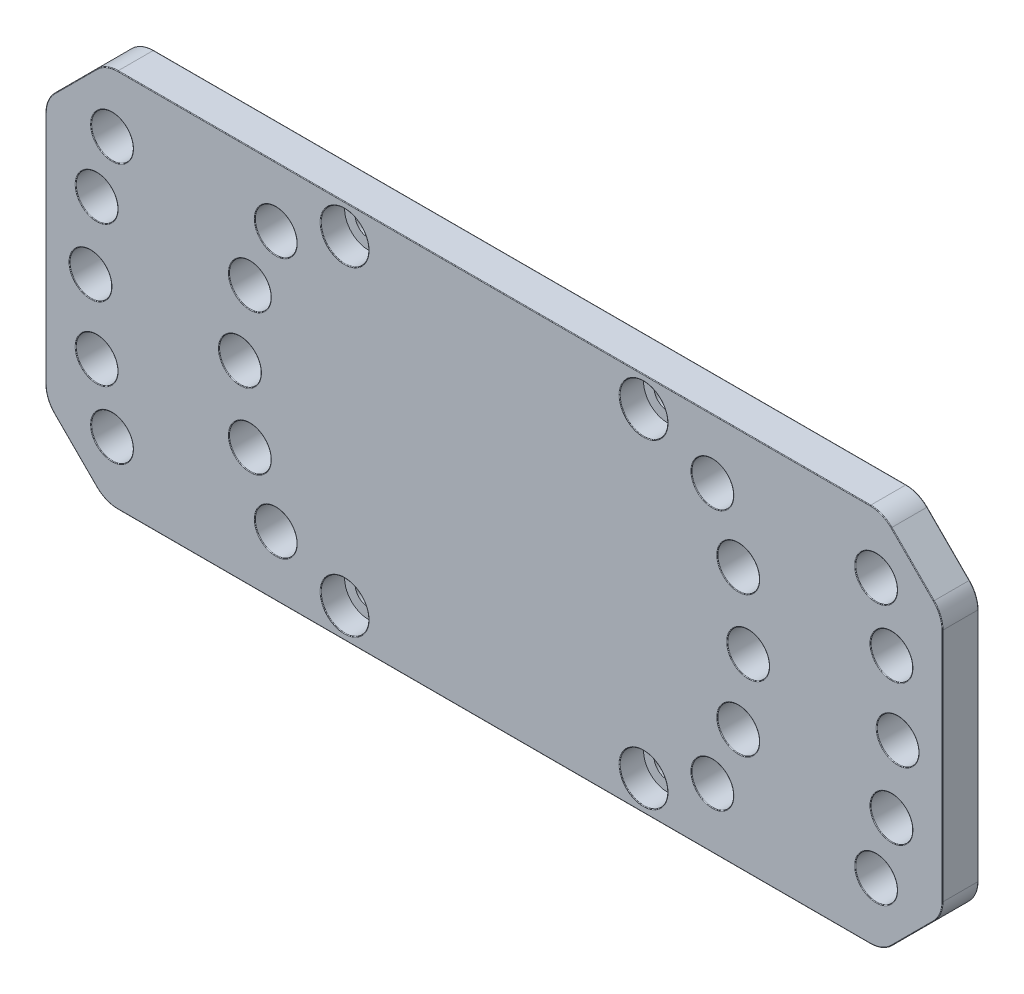
from build123d import *

# Parameters (mm, degrees)
EXTRUDE_2_DEPTH             = 6
HOLE_WIZARD_M41_D           = 4.5
HOLE_WIZARD_M41_CBORE_D     = 8
HOLE_WIZARD_M41_CBORE_DEPTH = 4
SKETCH_13_R                 = 3.5
CUT_EXTRUDE_1_DEPTH         = 82.664328198
FILLET_1_R                  = 5
FILLET_2_R                  = 0.1


with BuildPart() as part:
    # Эскиз5 → Бобышка-Вытянуть2 (new body)
    with BuildSketch(Plane.XY):
        Polygon((-75, 21.75), (-65, 31.75), (65, 31.75), (75, 21.75), (75, -21.75), (65, -31.75), (-65, -31.75), (-75, -21.75), align=None)
    extrude(amount=EXTRUDE_2_DEPTH)

    # Цековка для винта с внутренним шестигранником M41 (through all)
    with Locations(Plane.XY.offset(6)):
        with Locations((-25, 26.75), (-25, -26.75), (25, -26.75), (25, 26.75)):
            CounterBoreHole(HOLE_WIZARD_M41_D / 2, HOLE_WIZARD_M41_CBORE_D / 2, HOLE_WIZARD_M41_CBORE_DEPTH)

    # Эскиз13 → Вырез-Вытянуть1 (cut, through all)
    with BuildSketch(Plane.XY.offset(6)):
        with Locations((-67.5, 0)):
            Circle(SKETCH_13_R)
        with Locations((-66.469447869, 11.75)):
            Circle(SKETCH_13_R)
        with Locations((-63.899823943, 21.75)):
            Circle(SKETCH_13_R)
        with Locations((-66.469447869, -11.75)):
            Circle(SKETCH_13_R)
        with Locations((-63.899823943, -21.75)):
            Circle(SKETCH_13_R)
        with Locations(Location((63.899823943, -21.75, 0), (0, 0, 180))):
            Circle(SKETCH_13_R)
        with Locations(Location((66.469447869, -11.75, 0), (0, 0, 180))):
            Circle(SKETCH_13_R)
        with Locations(Location((67.5, 0, 0), (0, 0, 180))):
            Circle(SKETCH_13_R)
        with Locations(Location((66.469447869, 11.75, 0), (0, 0, 180))):
            Circle(SKETCH_13_R)
        with Locations(Location((63.899823943, 21.75, 0), (0, 0, 180))):
            Circle(SKETCH_13_R)
        with Locations((-36.512840207, 21.75)):
            Circle(SKETCH_13_R)
        with Locations((-40.843451127, 11.75)):
            Circle(SKETCH_13_R)
        with Locations((-42.5, 0)):
            Circle(SKETCH_13_R)
        with Locations((-40.843451127, -11.75)):
            Circle(SKETCH_13_R)
        with Locations((-36.512840207, -21.75)):
            Circle(SKETCH_13_R)
        with Locations(Location((36.512840207, -21.75, 0), (0, 0, 180))):
            Circle(SKETCH_13_R)
        with Locations(Location((40.843451127, -11.75, 0), (0, 0, 180))):
            Circle(SKETCH_13_R)
        with Locations(Location((42.5, 0, 0), (0, 0, 180))):
            Circle(SKETCH_13_R)
        with Locations(Location((40.843451127, 11.75, 0), (0, 0, 180))):
            Circle(SKETCH_13_R)
        with Locations(Location((36.512840207, 21.75, 0), (0, 0, 180))):
            Circle(SKETCH_13_R)
    extrude(amount=-CUT_EXTRUDE_1_DEPTH, mode=Mode.SUBTRACT)

    # Скругление1
    fillet_1_edges = [part.edges().sort_by_distance(p)[0] for p in [
        (65, 31.75, 3),
        (75, 21.75, 3),
        (75, -21.75, 3),
        (65, -31.75, 3),
        (-65, -31.75, 3),
        (-75, -21.75, 3),
        (-75, 21.75, 3),
        (-65, 31.75, 3),
    ]]
    fillet(fillet_1_edges, radius=FILLET_1_R)

    # Скругление2
    fillet_2_edges = [part.edges().sort_by_distance(p)[0] for p in [
        (-44.343451127, -11.75, 0),
        (-44.343451127, -11.75, 6),
        (-40.012840207, -21.75, 0),
        (-40.012840207, -21.75, 6),
        (40.012840207, -21.75, 0),
        (40.012840207, -21.75, 6),
        (44.343451127, -11.75, 0),
        (44.343451127, -11.75, 6),
        (46, 0, 0),
        (46, 0, 6),
        (44.343451127, 11.75, 0),
        (44.343451127, 11.75, 6),
        (40.012840207, 21.75, 0),
        (40.012840207, 21.75, 6),
        (0, 31.75, 0),
        (0, 31.75, 6),
        (70, 26.75, 0),
        (75, 0, 0),
        (70, -26.75, 0),
        (0, -31.75, 0),
        (-70, -26.75, 0),
        (-75, 0, 0),
        (-70, 26.75, 0),
        (-64.84234935, 31.369397663, 0),
        (-74.619397663, 21.59234935, 0),
        (-74.619397663, -21.59234935, 0),
        (-64.84234935, -31.369397663, 0),
        (64.84234935, -31.369397663, 0),
        (74.619397663, -21.59234935, 0),
        (74.619397663, 21.59234935, 0),
        (64.84234935, 31.369397663, 0),
        (70, 26.75, 6),
        (-70, 26.75, 6),
        (-75, 0, 6),
        (-70, -26.75, 6),
        (0, -31.75, 6),
        (70, -26.75, 6),
        (75, 0, 6),
        (-64.84234935, 31.369397663, 6),
        (-74.619397663, 21.59234935, 6),
        (-74.619397663, -21.59234935, 6),
        (-64.84234935, -31.369397663, 6),
        (64.84234935, -31.369397663, 6),
        (74.619397663, -21.59234935, 6),
        (74.619397663, 21.59234935, 6),
        (64.84234935, 31.369397663, 6),
        (21, 26.75, 6),
        (27.25, 26.75, 0),
        (21, -26.75, 6),
        (27.25, -26.75, 0),
        (-29, -26.75, 6),
        (-22.75, -26.75, 0),
        (-29, 26.75, 6),
        (-22.75, 26.75, 0),
        (-71, 0, 0),
        (-71, 0, 6),
        (-69.969447869, 11.75, 0),
        (-69.969447869, 11.75, 6),
        (-67.399823943, 21.75, 0),
        (-67.399823943, 21.75, 6),
        (-69.969447869, -11.75, 0),
        (-69.969447869, -11.75, 6),
        (-67.399823943, -21.75, 0),
        (-67.399823943, -21.75, 6),
        (67.399823943, -21.75, 0),
        (67.399823943, -21.75, 6),
        (69.969447869, -11.75, 0),
        (69.969447869, -11.75, 6),
        (71, 0, 0),
        (71, 0, 6),
        (69.969447869, 11.75, 0),
        (69.969447869, 11.75, 6),
        (67.399823943, 21.75, 0),
        (67.399823943, 21.75, 6),
        (-40.012840207, 21.75, 0),
        (-40.012840207, 21.75, 6),
        (-44.343451127, 11.75, 0),
        (-44.343451127, 11.75, 6),
        (-46, 0, 0),
        (-46, 0, 6),
    ]]
    fillet(fillet_2_edges, radius=FILLET_2_R)


solid = part.part
